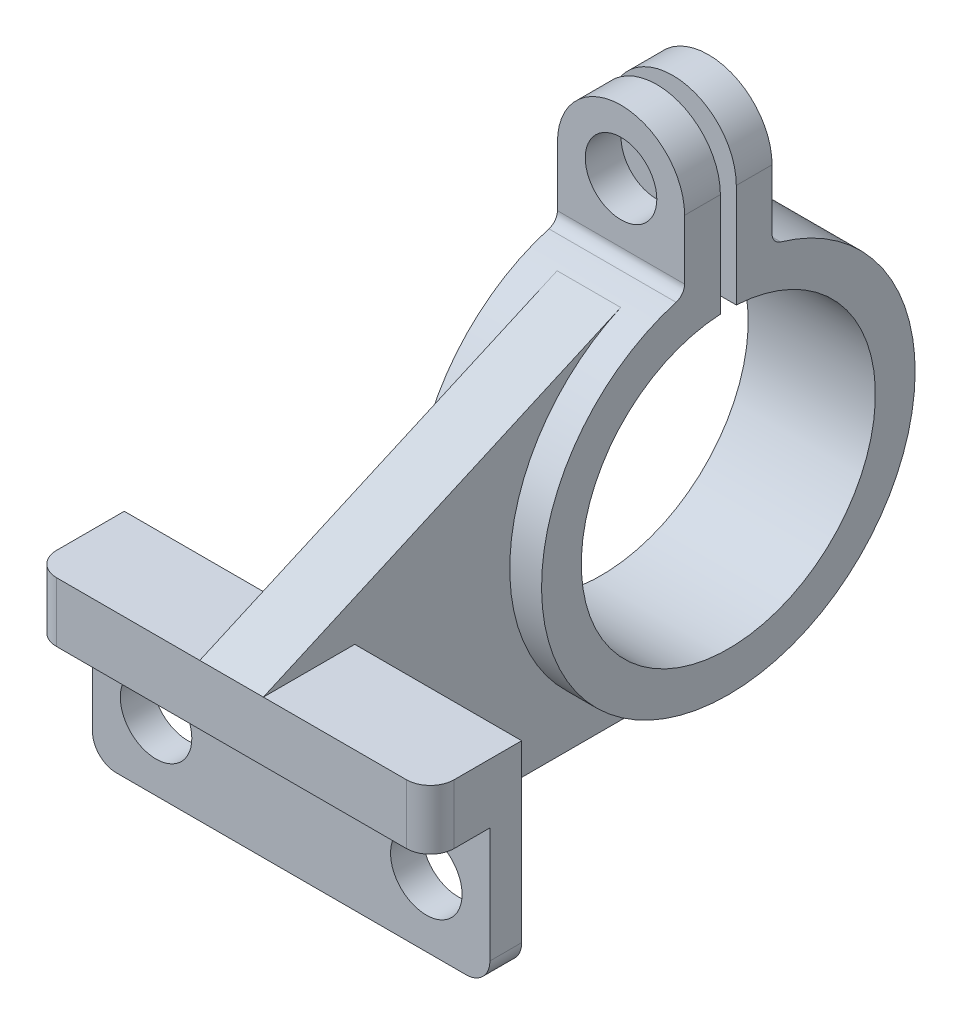
from build123d import *

# Parameters (mm, degrees)
SKETCH_2_R             = 47
SKETCH_2_R_2           = 37
EXTRUDE_579_DEPTH      = 16
SKETCH_3_R             = 9
EXTRUDE_773_DEPTH      = 11
SKETCH_6_W             = 4
SKETCH_6_H             = 45
CUT_EXTRUDE_1_DEPTH    = 16
FILLET_1_R             = 3
EXTRUDE_1292_DEPTH     = 50
SKETCH_18_R            = 9
CUT_EXTRUDE_1513_DEPTH = 8
FILLET_3_R             = 6
EXTRUDE_1878_DEPTH     = 8


with BuildPart() as part:
    # 草圖2 → Extrude 579 (new, symmetric)
    with BuildSketch(Plane(origin=(0, 0, 0), x_dir=(0, 0, -1), z_dir=(1, 0, 0))):
        Circle(SKETCH_2_R)
        Circle(SKETCH_2_R_2, mode=Mode.SUBTRACT)
    extrude(amount=EXTRUDE_579_DEPTH, both=True)

    # 草圖3 → Extrude 773 (add, symmetric)
    with BuildSketch(Plane.XY):
        with BuildLine():
            Line((16, 37), (-16, 37))
            Line((-16, 37), (-16, 63))
            ThreePointArc((-16, 63), (0, 79), (16, 63))
            Line((16, 63), (16, 37))
        make_face()
        with Locations((0, 63)):
            Circle(SKETCH_3_R, mode=Mode.SUBTRACT)
    extrude(amount=EXTRUDE_773_DEPTH, both=True)

    # 草圖6 → 除料-伸長1 (cut, symmetric)
    with BuildSketch(Plane(origin=(0, 0, 0), x_dir=(0, 0, -1), z_dir=(1, 0, 0))):
        with Locations((0, 59.445906404)):
            Rectangle(SKETCH_6_W, SKETCH_6_H)
    extrude(amount=CUT_EXTRUDE_1_DEPTH, both=True, mode=Mode.SUBTRACT)

    # 圓角1
    fillet_1_edges = [part.edges().sort_by_distance(p)[0] for p in [
        (0, 45.694638635, -11),
        (0, 45.694638635, 11),
    ]]
    fillet(fillet_1_edges, radius=FILLET_1_R)



with BuildPart() as body_2:
    # 草圖14 → Extrude 1292 (new, symmetric)
    with BuildSketch(Plane(origin=(0, 0, 0), x_dir=(0, 0, -1), z_dir=(1, 0, 0))):
        Polygon((-94, -47), (-86, -47), (-86, 3), (-109, 3), (-109, -12), (-94, -12), align=None)
    extrude(amount=EXTRUDE_1292_DEPTH, both=True)

    # 草圖18 → Cut-Extrude 1513 (cut)
    with BuildSketch(Plane.XY.offset(94)):
        with Locations((-34, -30)):
            Circle(SKETCH_18_R)
        with Locations((34, -30)):
            Circle(SKETCH_18_R)
    extrude(amount=-CUT_EXTRUDE_1513_DEPTH, mode=Mode.SUBTRACT)

    # 圓角3
    fillet_3_edges = [body_2.edges().sort_by_distance(p)[0] for p in [
        (50, -4.5, 109),
        (-50, -4.5, 109),
        (50, -47, 90),
        (-50, -47, 90),
    ]]
    fillet(fillet_3_edges, radius=FILLET_3_R)


with BuildPart() as part_1:
    add(part.part)

    add(body_2.part)  # Extrude 1878 merges body 2
    # 草圖20 → Extrude 1878 (add, symmetric)
    with BuildSketch(Plane(origin=(0, 0, 0), x_dir=(0, 0, -1), z_dir=(1, 0, 0))):
        with BuildLine():
            Line((-109, 3), (-19.083912356, 42.951184957))
            ThreePointArc((-19.083912356, 42.951184957), (-45.976655465, -9.754340243), (0, -47))
            Line((0, -47), (-86, -47))
            Line((-86, -47), (-86, 3))
            Line((-86, 3), (-109, 3))
        make_face()
    extrude(amount=EXTRUDE_1878_DEPTH, both=True)


solid = part_1.part
